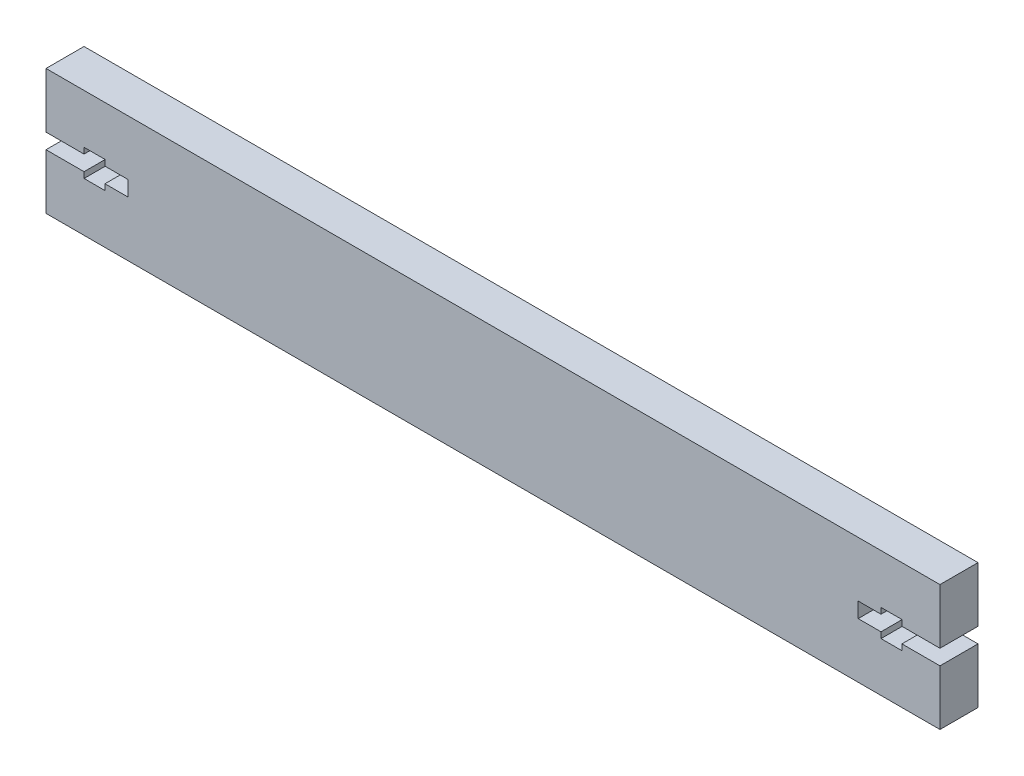
from build123d import *

# Parameters (mm, degrees)
ESQUISSE1_W             = 235
ESQUISSE1_H             = 33
BOSS_EXTRU_1_DEPTH      = 10
ENL_V_MAT_EXTRU_1_DEPTH = 10


with BuildPart() as part:
    # Esquisse1 → Boss.-Extru.1 (new body)
    with BuildSketch(Plane.XY):
        Rectangle(ESQUISSE1_W, ESQUISSE1_H)
    extrude(amount=BOSS_EXTRU_1_DEPTH)

    # Esquisse2 → Enlèv. mat.-Extru.1 (cut)
    with BuildSketch(Plane.XY.offset(10)):
        Polygon((-117.5, 2), (-107.5, 2), (-107.5, 3.55), (-102, 3.55), (-102, 2), (-96, 2), (-96, -2), (-102, -2), (-102, -3.55), (-107.5, -3.55), (-107.5, -2), (-117.5, -2), align=None)
        Polygon((117.5, -2), (107.5, -2), (107.5, -3.55), (102, -3.55), (102, -2), (96, -2), (96, 2), (102, 2), (102, 3.55), (107.5, 3.55), (107.5, 2), (117.5, 2), align=None)
    extrude(amount=-ENL_V_MAT_EXTRU_1_DEPTH, mode=Mode.SUBTRACT)


solid = part.part
